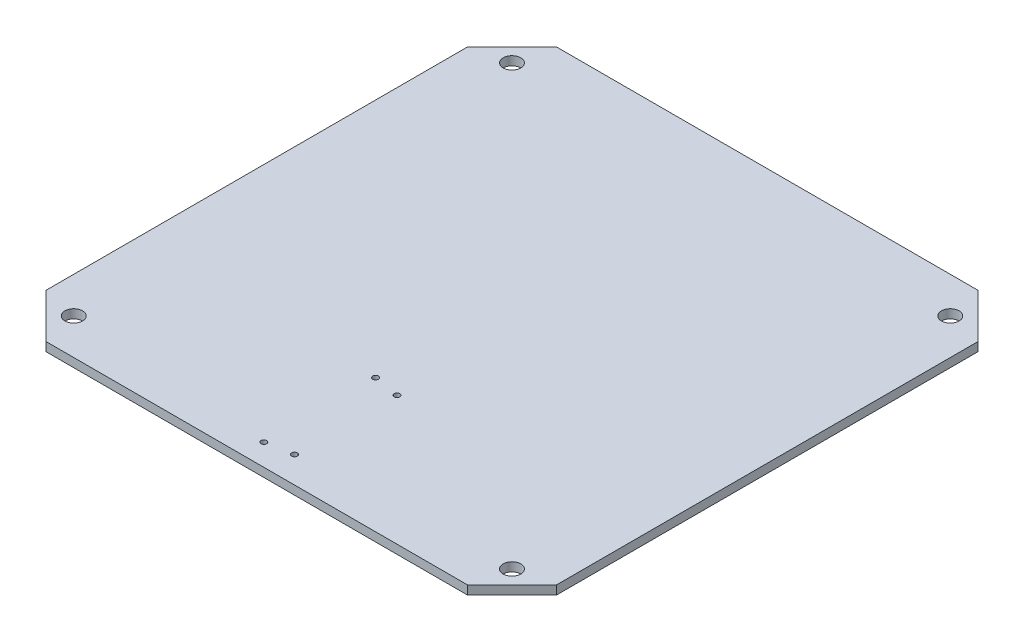
from build123d import *

# Parameters (mm, degrees)
BOSS_EXTRUDE1_DEPTH = 1.59
SKETCH3_R           = 1.59
SKETCH3_R_2         = 0.51
CUT_EXTRUDE1_DEPTH  = 66.073251801


with BuildPart() as part:
    # Sketch1 → Boss-Extrude1 (new body)
    with BuildSketch(Plane(origin=(0, 0, 0), x_dir=(1, 0, 0), z_dir=(0, 1, 0))):
        Polygon((-38, 46), (-46, 38), (-46, -38), (-38, -46), (38, -46), (46, -38), (46, 38), (38, 46), align=None)
    extrude(amount=BOSS_EXTRUDE1_DEPTH)

    # Sketch3 → Cut-Extrude1 (cut, through all)
    with BuildSketch(Plane(origin=(0, 1.59, 0), x_dir=(1, 0, 0), z_dir=(0, 1, 0))):
        with Locations(Location((-39.5, 39.5, 0), (0, 0, 270))):
            Circle(SKETCH3_R)
        with Locations(Location((39.5, 39.5, 0), (0, 0, 270))):
            Circle(SKETCH3_R)
        with Locations(Location((39.5, -39.5, 0), (0, 0, 270))):
            Circle(SKETCH3_R)
        with Locations(Location((-39.5, -39.5, 0), (0, 0, 270))):
            Circle(SKETCH3_R)
        with Locations(Location((-2.67, -21.93, 0), (0, 0, 270))):
            Circle(SKETCH3_R_2)
        with Locations(Location((2.03, -22.75, 0), (0, 0, 270))):
            Circle(SKETCH3_R_2)
        with Locations(Location((-2.67, -42.07, 0), (0, 0, 270))):
            Circle(SKETCH3_R_2)
        with Locations(Location((2.03, -41.24, 0), (0, 0, 270))):
            Circle(SKETCH3_R_2)
    extrude(amount=-CUT_EXTRUDE1_DEPTH, mode=Mode.SUBTRACT)


solid = part.part
